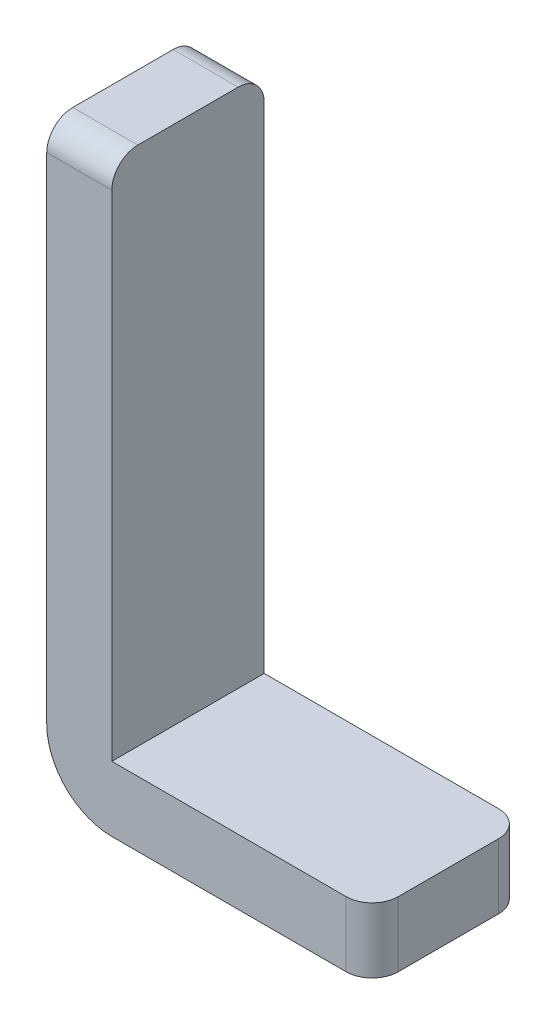
from build123d import *

# Parameters (mm, degrees)
SKETCH1_W           = 25
SKETCH1_H           = 11.704143749
BOSS_EXTRUDE1_DEPTH = 5
SKETCH2_W           = 5
SKETCH2_H           = 11.704143749
BOSS_EXTRUDE2_DEPTH = 40
FILLET1_R           = 5
FILLET2_R           = 2


with BuildPart() as part:
    # Sketch1 → Boss-Extrude1 (new body)
    with BuildSketch(Plane(origin=(0, 0, 0), x_dir=(1, 0, 0), z_dir=(0, 1, 0))):
        with Locations((12.5, 5.852071874)):
            Rectangle(SKETCH1_W, SKETCH1_H)
    extrude(amount=BOSS_EXTRUDE1_DEPTH)

    # Sketch2 → Boss-Extrude2 (add)
    with BuildSketch(Plane(origin=(0, 5, 0), x_dir=(1, 0, 0), z_dir=(0, 1, 0))):
        with Locations((2.5, 5.852071874)):
            Rectangle(SKETCH2_W, SKETCH2_H)
    extrude(amount=BOSS_EXTRUDE2_DEPTH)

    # Fillet1
    fillet1_edges = [part.edges().sort_by_distance(p)[0] for p in [
        (0, 0, -5.852071875),
    ]]
    fillet(fillet1_edges, radius=FILLET1_R)

    # Fillet2
    fillet2_edges = [part.edges().sort_by_distance(p)[0] for p in [
        (2.5, 45, 0),
        (2.5, 45, -11.704143749),
        (25, 2.5, -11.704143749),
        (25, 2.5, 0),
    ]]
    fillet(fillet2_edges, radius=FILLET2_R)


solid = part.part
